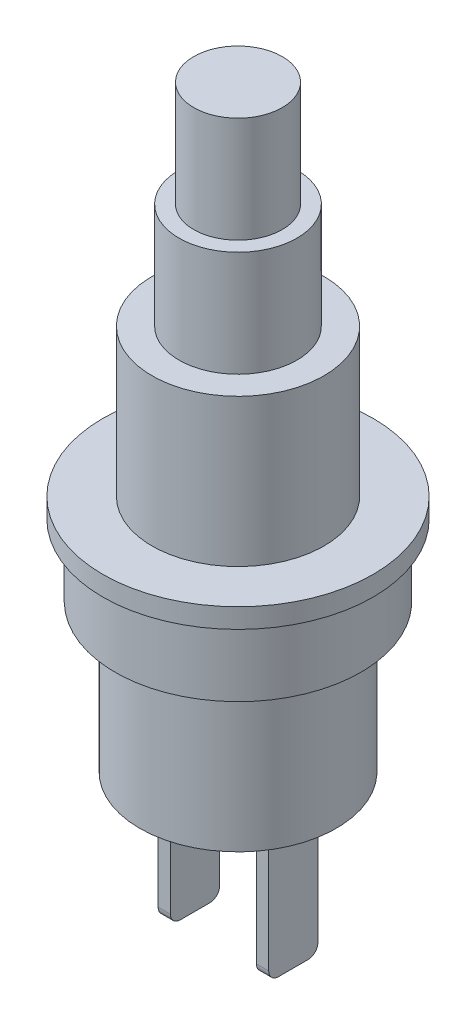
from build123d import *

# Parameters (mm, degrees)
BOSS_EXTRU_1_DEPTH      = 1
BOSS_EXTRU_1_DEPTH_BACK = 1
ESQUISSE2_W             = 0.5
ESQUISSE2_H             = 5.8
CONG_2_R                = 0.4


with BuildPart() as part:
    # Esquisse1 → Révolution1 (revolve)
    with BuildSketch(Plane.XY):
        Polygon((0, 0), (0, 24.3), (-1.8, 24.3), (-1.8, 20), (-2.4, 20), (-2.4, 15.7), (-3.5, 15.7), (-3.5, 9.7), (-5.5, 9.7), (-5.5, 8.9), (-5, 8.9), (-5, 6), (-4, 6), (-4, 0), align=None)
    revolve(axis=Axis((0, 0, 0), (0, 1, 0)))

    # Esquisse2 → Boss.-Extru.1 (add, two sides: drawn at the far end of the back side and taken through both)
    with BuildSketch(Plane.XY.offset(-BOSS_EXTRU_1_DEPTH_BACK)):
        with Locations((-2, -2.9)):
            Rectangle(ESQUISSE2_W, ESQUISSE2_H)
        with Locations((2, -2.9)):
            Rectangle(ESQUISSE2_W, ESQUISSE2_H)
    extrude(amount=BOSS_EXTRU_1_DEPTH + BOSS_EXTRU_1_DEPTH_BACK)

    # Congé2
    cong_2_edges = [part.edges().sort_by_distance(p)[0] for p in [
        (2, -5.8, 1),
        (-2, -5.8, -1),
        (-2, -5.8, 1),
        (2, -5.8, -1),
    ]]
    fillet(cong_2_edges, radius=CONG_2_R)


solid = part.part
